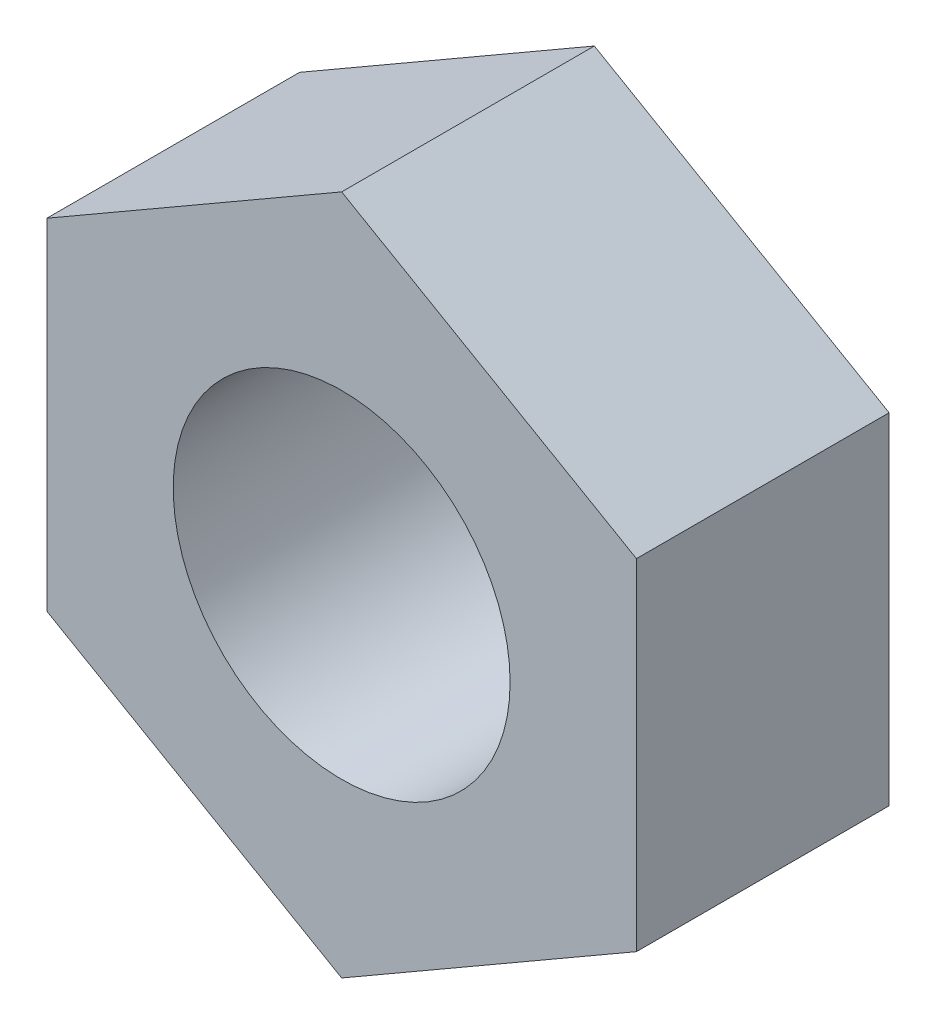
from build123d import *

# Parameters (mm, degrees)
SKETCH1_R           = 2
BOSS_EXTRUDE1_DEPTH = 3


with BuildPart() as part:
    # Sketch1 → Boss-Extrude1 (new body)
    with BuildSketch(Plane.XY):
        Polygon((0, 4.041451884), (-3.5, 2.020725942), (-3.5, -2.020725942), (0, -4.041451884), (3.5, -2.020725942), (3.5, 2.020725942), align=None)
        Circle(SKETCH1_R, mode=Mode.SUBTRACT)
    extrude(amount=BOSS_EXTRUDE1_DEPTH)


solid = part.part
